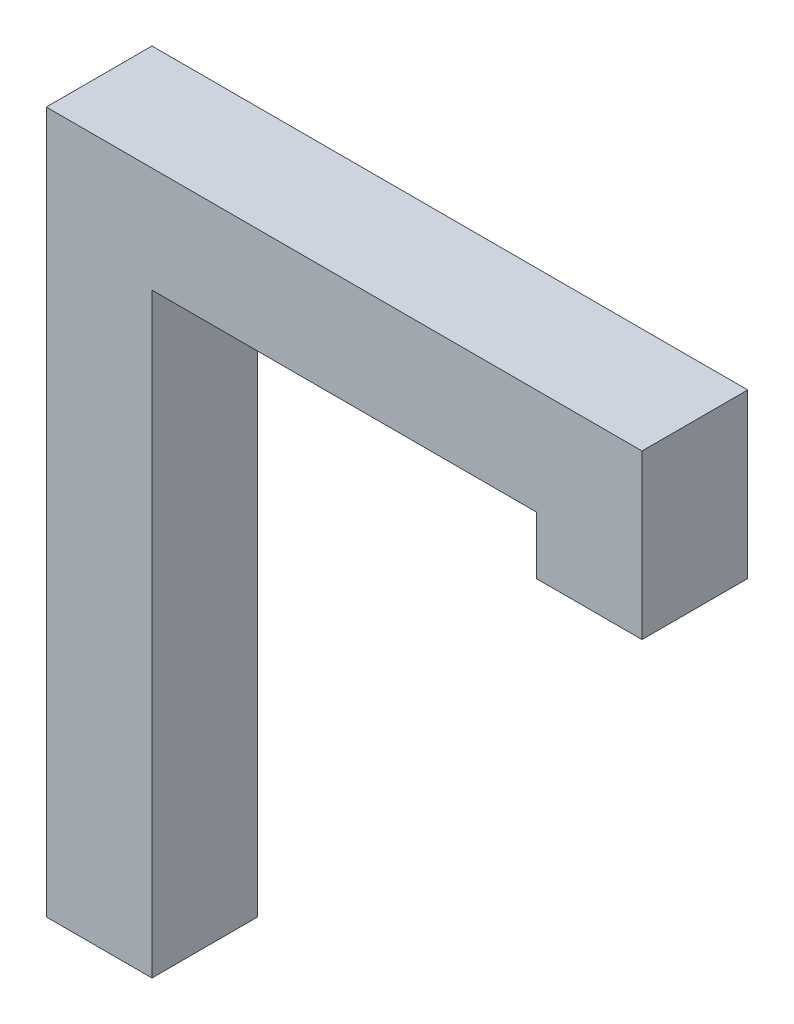
from build123d import *

# Parameters (mm, degrees)
EXTRUDE_1_DEPTH = 5.5


with BuildPart() as part:
    # ｽｹｯﾁ1 → ﾎﾞｽ - 押し出し1 (new body)
    with BuildSketch(Plane.XY):
        Polygon((0, 0), (-5.5, 0), (-5.5, 36.5), (25.5, 36.5), (25.5, 28), (20, 28), (20, 31), (0, 31), align=None)
    extrude(amount=EXTRUDE_1_DEPTH)


solid = part.part
